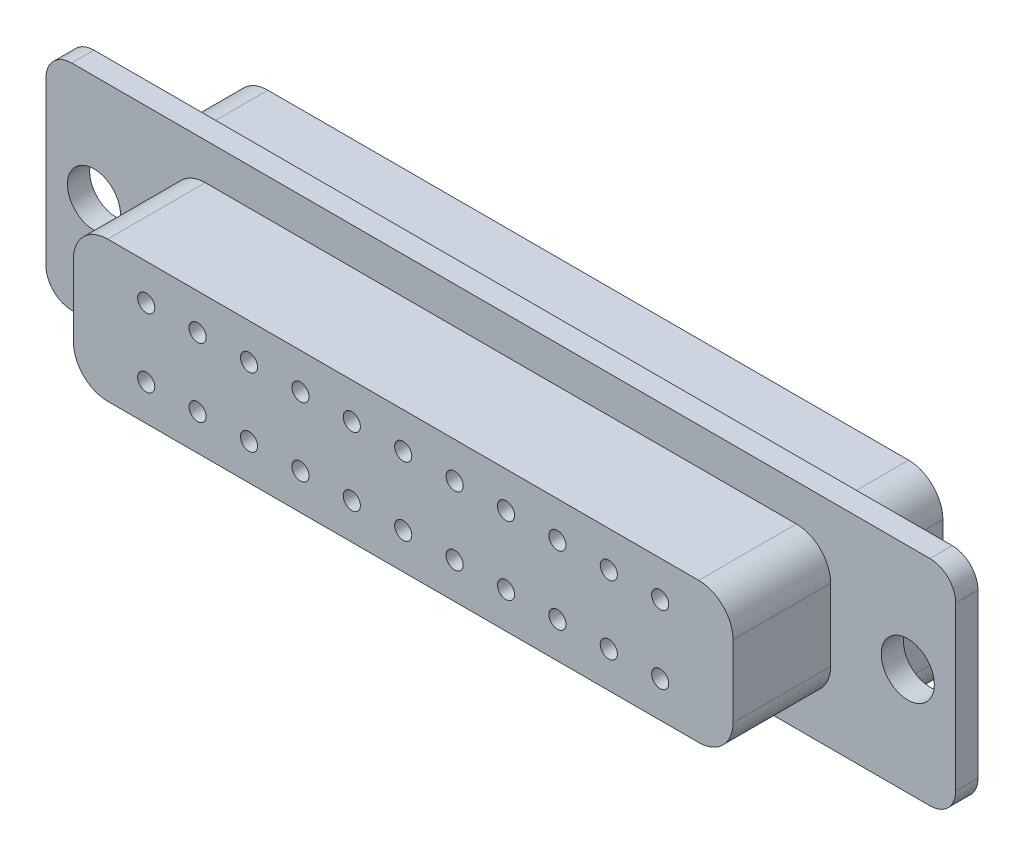
from build123d import *

# Parameters (mm, degrees)
BOSS_EXTRUDE1_DEPTH      = 1.3
BOSS_EXTRUDE2_DEPTH      = 3.8
BOSS_EXTRUDE3_DEPTH      = 5.7
SKETCH4_R                = 0.5
CUT_EXTRUDE1_DEPTH       = 5.7
LPATTERN1_COUNT          = 6
LPATTERN1_PITCH          = 3
MIRROR1_COPY_1_SKETCH_R  = 0.5
MIRROR1_COPY_1_DEPTH     = 5.7
MIRROR1_COPY_2_SKETCH_R  = 0.5
MIRROR1_COPY_2_DEPTH     = 5.7
MIRROR1_COPY_3_SKETCH_R  = 0.5
MIRROR1_COPY_3_DEPTH     = 5.7
MIRROR1_COPY_4_SKETCH_R  = 0.5
MIRROR1_COPY_4_DEPTH     = 5.7
MIRROR1_COPY_5_SKETCH_R  = 0.5
MIRROR1_COPY_5_DEPTH     = 5.7
MIRROR2_COPY_1_SKETCH_R  = 0.5
MIRROR2_COPY_1_DEPTH     = 5.7
MIRROR2_COPY_2_SKETCH_R  = 0.5
MIRROR2_COPY_2_DEPTH     = 5.7
MIRROR2_COPY_3_SKETCH_R  = 0.5
MIRROR2_COPY_3_DEPTH     = 5.7
MIRROR2_COPY_4_SKETCH_R  = 0.5
MIRROR2_COPY_4_DEPTH     = 5.7
MIRROR2_COPY_5_SKETCH_R  = 0.5
MIRROR2_COPY_5_DEPTH     = 5.7
MIRROR2_COPY_6_SKETCH_R  = 0.5
MIRROR2_COPY_6_DEPTH     = 5.7
MIRROR2_COPY_7_SKETCH_R  = 0.5
MIRROR2_COPY_7_DEPTH     = 5.7
MIRROR2_COPY_8_SKETCH_R  = 0.5
MIRROR2_COPY_8_DEPTH     = 5.7
MIRROR2_COPY_9_SKETCH_R  = 0.5
MIRROR2_COPY_9_DEPTH     = 5.7
MIRROR2_COPY_10_SKETCH_R = 0.5
MIRROR2_COPY_10_DEPTH    = 5.7
MIRROR2_COPY_11_SKETCH_R = 0.5
MIRROR2_COPY_11_DEPTH    = 5.7
MIRROR2_COPY_12_SKETCH_R = 0.5
MIRROR2_COPY_12_DEPTH    = 5.7
MIRROR2_COPY_13_SKETCH_R = 0.5
MIRROR2_COPY_13_DEPTH    = 5.7
SKETCH5_R                = 1.55
CUT_EXTRUDE2_DEPTH       = 28.864942132


with BuildPart() as part:
    # Sketch1 → Boss-Extrude1 (new body)
    with BuildSketch(Plane.XY):
        with BuildLine():
            Line((-25.05, -6.25), (25.05, -6.25))
            ThreePointArc((25.05, -6.25), (26.110660172, -5.810660172), (26.55, -4.75))
            Line((26.55, -4.75), (26.55, 4.75))
            ThreePointArc((26.55, 4.75), (26.110660172, 5.810660172), (25.05, 6.25))
            Line((25.05, 6.25), (-25.05, 6.25))
            ThreePointArc((-25.05, 6.25), (-26.110660172, 5.810660172), (-26.55, 4.75))
            Line((-26.55, 4.75), (-26.55, -4.75))
            ThreePointArc((-26.55, -4.75), (-26.110660172, -5.810660172), (-25.05, -6.25))
        make_face()
    extrude(amount=BOSS_EXTRUDE1_DEPTH)

    # Sketch2 → Boss-Extrude2 (add)
    with BuildSketch(Plane(origin=(0, 0, 0), x_dir=(-1, 0, 0), z_dir=(0, 0, -1))):
        with BuildLine():
            Line((-18.7, -5.5), (18.7, -5.5))
            ThreePointArc((18.7, -5.5), (20.114213562, -4.914213562), (20.7, -3.5))
            Line((20.7, -3.5), (20.7, 3.5))
            ThreePointArc((20.7, 3.5), (20.114213562, 4.914213562), (18.7, 5.5))
            Line((18.7, 5.5), (-18.7, 5.5))
            ThreePointArc((-18.7, 5.5), (-20.114213562, 4.914213562), (-20.7, 3.5))
            Line((-20.7, 3.5), (-20.7, -3.5))
            ThreePointArc((-20.7, -3.5), (-20.114213562, -4.914213562), (-18.7, -5.5))
        make_face()
    extrude(amount=BOSS_EXTRUDE2_DEPTH)

    # Sketch3 → Boss-Extrude3 (add)
    with BuildSketch(Plane.XY.offset(1.3)):
        with BuildLine():
            Line((-17.25, -4.1), (17.25, -4.1))
            ThreePointArc((17.25, -4.1), (18.664213562, -3.514213562), (19.25, -2.1))
            Line((19.25, -2.1), (19.25, 2.1))
            ThreePointArc((19.25, 2.1), (18.664213562, 3.514213562), (17.25, 4.1))
            Line((17.25, 4.1), (-17.25, 4.1))
            ThreePointArc((-17.25, 4.1), (-18.664213562, 3.514213562), (-19.25, 2.1))
            Line((-19.25, 2.1), (-19.25, -2.1))
            ThreePointArc((-19.25, -2.1), (-18.664213562, -3.514213562), (-17.25, -4.1))
        make_face()
    extrude(amount=BOSS_EXTRUDE3_DEPTH)

    # Sketch4 → Cut-Extrude1 (cut)
    with BuildSketch(Plane.XY.offset(7)):
        with Locations((0, 2)):
            Circle(SKETCH4_R)
    cut_extrude1 = extrude(amount=-CUT_EXTRUDE1_DEPTH, mode=Mode.SUBTRACT)

    # LPattern1: Cut-Extrude1 ×6
    with Locations(*[(i * LPATTERN1_PITCH, 0, 0) for i in range(1, LPATTERN1_COUNT)]):
        add(cut_extrude1, mode=Mode.SUBTRACT)

    # Mirror1: Cut-Extrude1 across plane
    add(cut_extrude1.mirror(Plane.ZX), mode=Mode.SUBTRACT)

    # Mirror1 copy 1 sketch → Mirror1 copy 1 (cut)
    with BuildSketch(Plane(origin=(3, 0, 7), x_dir=(1, 0, 0), z_dir=(0, 0, 1))):
        with Locations((0, -2)):
            Circle(MIRROR1_COPY_1_SKETCH_R)
    extrude(amount=-MIRROR1_COPY_1_DEPTH, mode=Mode.SUBTRACT)

    # Mirror1 copy 2 sketch → Mirror1 copy 2 (cut)
    with BuildSketch(Plane(origin=(6, 0, 7), x_dir=(1, 0, 0), z_dir=(0, 0, 1))):
        with Locations((0, -2)):
            Circle(MIRROR1_COPY_2_SKETCH_R)
    extrude(amount=-MIRROR1_COPY_2_DEPTH, mode=Mode.SUBTRACT)

    # Mirror1 copy 3 sketch → Mirror1 copy 3 (cut)
    with BuildSketch(Plane(origin=(9, 0, 7), x_dir=(1, 0, 0), z_dir=(0, 0, 1))):
        with Locations((0, -2)):
            Circle(MIRROR1_COPY_3_SKETCH_R)
    extrude(amount=-MIRROR1_COPY_3_DEPTH, mode=Mode.SUBTRACT)

    # Mirror1 copy 4 sketch → Mirror1 copy 4 (cut)
    with BuildSketch(Plane(origin=(12, 0, 7), x_dir=(1, 0, 0), z_dir=(0, 0, 1))):
        with Locations((0, -2)):
            Circle(MIRROR1_COPY_4_SKETCH_R)
    extrude(amount=-MIRROR1_COPY_4_DEPTH, mode=Mode.SUBTRACT)

    # Mirror1 copy 5 sketch → Mirror1 copy 5 (cut)
    with BuildSketch(Plane(origin=(15, 0, 7), x_dir=(1, 0, 0), z_dir=(0, 0, 1))):
        with Locations((0, -2)):
            Circle(MIRROR1_COPY_5_SKETCH_R)
    extrude(amount=-MIRROR1_COPY_5_DEPTH, mode=Mode.SUBTRACT)

    # Mirror2 copy 1 sketch → Mirror2 copy 1 (cut)
    with BuildSketch(Plane(origin=(-3, 0, 7), x_dir=(-1, 0, 0), z_dir=(0, 0, 1))):
        with Locations((0, -2)):
            Circle(MIRROR2_COPY_1_SKETCH_R)
    extrude(amount=-MIRROR2_COPY_1_DEPTH, mode=Mode.SUBTRACT)

    # Mirror2 copy 2 sketch → Mirror2 copy 2 (cut)
    with BuildSketch(Plane(origin=(-6, 0, 7), x_dir=(-1, 0, 0), z_dir=(0, 0, 1))):
        with Locations((0, -2)):
            Circle(MIRROR2_COPY_2_SKETCH_R)
    extrude(amount=-MIRROR2_COPY_2_DEPTH, mode=Mode.SUBTRACT)

    # Mirror2 copy 3 sketch → Mirror2 copy 3 (cut)
    with BuildSketch(Plane(origin=(-9, 0, 7), x_dir=(-1, 0, 0), z_dir=(0, 0, 1))):
        with Locations((0, -2)):
            Circle(MIRROR2_COPY_3_SKETCH_R)
    extrude(amount=-MIRROR2_COPY_3_DEPTH, mode=Mode.SUBTRACT)

    # Mirror2 copy 4 sketch → Mirror2 copy 4 (cut)
    with BuildSketch(Plane(origin=(-12, 0, 7), x_dir=(-1, 0, 0), z_dir=(0, 0, 1))):
        with Locations((0, -2)):
            Circle(MIRROR2_COPY_4_SKETCH_R)
    extrude(amount=-MIRROR2_COPY_4_DEPTH, mode=Mode.SUBTRACT)

    # Mirror2 copy 5 sketch → Mirror2 copy 5 (cut)
    with BuildSketch(Plane(origin=(-15, 0, 7), x_dir=(-1, 0, 0), z_dir=(0, 0, 1))):
        with Locations((0, -2)):
            Circle(MIRROR2_COPY_5_SKETCH_R)
    extrude(amount=-MIRROR2_COPY_5_DEPTH, mode=Mode.SUBTRACT)

    # Mirror2 copy 6 sketch → Mirror2 copy 6 (cut)
    with BuildSketch(Plane(origin=(0, 0, 7), x_dir=(-1, 0, 0), z_dir=(0, 0, 1))):
        with Locations((0, -2)):
            Circle(MIRROR2_COPY_6_SKETCH_R)
    extrude(amount=-MIRROR2_COPY_6_DEPTH, mode=Mode.SUBTRACT)

    # Mirror2 copy 7 sketch → Mirror2 copy 7 (cut)
    with BuildSketch(Plane(origin=(0, 0, 7), x_dir=(-1, 0, 0), z_dir=(0, 0, 1))):
        with Locations((0, 2)):
            Circle(MIRROR2_COPY_7_SKETCH_R)
    extrude(amount=-MIRROR2_COPY_7_DEPTH, mode=Mode.SUBTRACT)

    # Mirror2 copy 8 sketch → Mirror2 copy 8 (cut)
    with BuildSketch(Plane(origin=(-3, 0, 7), x_dir=(-1, 0, 0), z_dir=(0, 0, 1))):
        with Locations((0, 2)):
            Circle(MIRROR2_COPY_8_SKETCH_R)
    extrude(amount=-MIRROR2_COPY_8_DEPTH, mode=Mode.SUBTRACT)

    # Mirror2 copy 9 sketch → Mirror2 copy 9 (cut)
    with BuildSketch(Plane(origin=(-6, 0, 7), x_dir=(-1, 0, 0), z_dir=(0, 0, 1))):
        with Locations((0, 2)):
            Circle(MIRROR2_COPY_9_SKETCH_R)
    extrude(amount=-MIRROR2_COPY_9_DEPTH, mode=Mode.SUBTRACT)

    # Mirror2 copy 10 sketch → Mirror2 copy 10 (cut)
    with BuildSketch(Plane(origin=(-9, 0, 7), x_dir=(-1, 0, 0), z_dir=(0, 0, 1))):
        with Locations((0, 2)):
            Circle(MIRROR2_COPY_10_SKETCH_R)
    extrude(amount=-MIRROR2_COPY_10_DEPTH, mode=Mode.SUBTRACT)

    # Mirror2 copy 11 sketch → Mirror2 copy 11 (cut)
    with BuildSketch(Plane(origin=(-12, 0, 7), x_dir=(-1, 0, 0), z_dir=(0, 0, 1))):
        with Locations((0, 2)):
            Circle(MIRROR2_COPY_11_SKETCH_R)
    extrude(amount=-MIRROR2_COPY_11_DEPTH, mode=Mode.SUBTRACT)

    # Mirror2 copy 12 sketch → Mirror2 copy 12 (cut)
    with BuildSketch(Plane(origin=(-15, 0, 7), x_dir=(-1, 0, 0), z_dir=(0, 0, 1))):
        with Locations((0, 2)):
            Circle(MIRROR2_COPY_12_SKETCH_R)
    extrude(amount=-MIRROR2_COPY_12_DEPTH, mode=Mode.SUBTRACT)

    # Mirror2 copy 13 sketch → Mirror2 copy 13 (cut)
    with BuildSketch(Plane(origin=(0, 0, 7), x_dir=(-1, 0, 0), z_dir=(0, 0, 1))):
        with Locations((0, -2)):
            Circle(MIRROR2_COPY_13_SKETCH_R)
    extrude(amount=-MIRROR2_COPY_13_DEPTH, mode=Mode.SUBTRACT)

    # Sketch5 → Cut-Extrude2 (cut, through all)
    with BuildSketch(Plane.XY.offset(1.3)):
        with Locations((23.75, 0)):
            Circle(SKETCH5_R)
    cut_extrude2 = extrude(amount=-CUT_EXTRUDE2_DEPTH, mode=Mode.SUBTRACT)

    # Mirror3: Cut-Extrude2 across plane
    add(cut_extrude2.mirror(Plane(origin=(0, 0, 0), x_dir=(0, 0, 1), z_dir=(1, 0, 0))), mode=Mode.SUBTRACT)


solid = part.part
